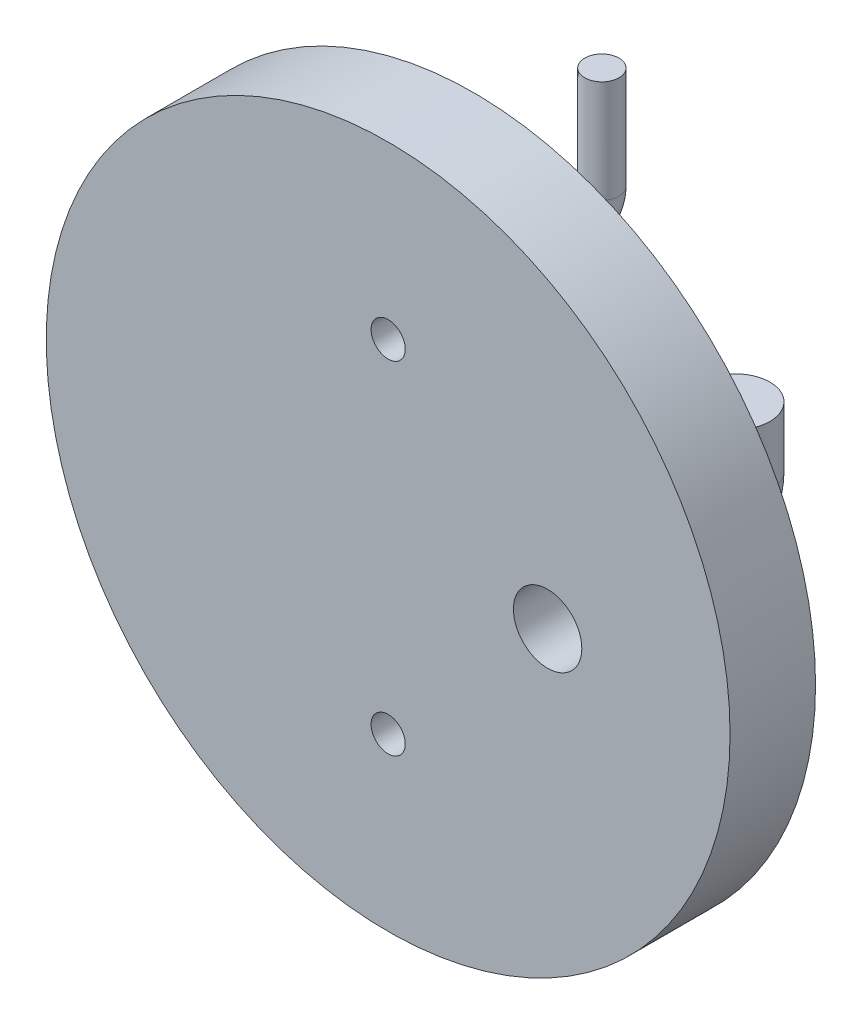
from build123d import *

# Parameters (mm, degrees)
SKETCH1_R           = 40
SKETCH1_R_2         = 2
SKETCH1_R_3         = 4
BOSS_EXTRUDE1_DEPTH = 10
SKETCH5_R           = 2
SKETCH3_R           = 2
SKETCH6_R           = 4


with BuildPart() as part:
    # Sketch1 → Boss-Extrude1 (new body)
    with BuildSketch(Plane.XY):
        Circle(SKETCH1_R)
        with Locations((0, 20)):
            Circle(SKETCH1_R_2, mode=Mode.SUBTRACT)
        with Locations((0, -20)):
            Circle(SKETCH1_R_2, mode=Mode.SUBTRACT)
        with Locations((18.65280258, 0)):
            Circle(SKETCH1_R_3, mode=Mode.SUBTRACT)
    extrude(amount=BOSS_EXTRUDE1_DEPTH)


with BuildPart() as body_2:
    # Sweep4: sweep along a path in Sketch4
    with BuildLine(Plane(origin=(0, 0, 0), x_dir=(0, 0, -1), z_dir=(1, 0, 0))) as sweep4_path:
        Line((17, -35), (17, -23))
        ThreePointArc((17, -23), (15.535533906, -19.464466094), (12, -18))
        Line((12, -18), (0, -18))
    # Sketch5 → Sweep4 (sweep)
    with BuildSketch(Plane.XY):
        with Locations((0, -20)):
            Circle(SKETCH5_R)
    sweep(path=sweep4_path.line)


with BuildPart() as body_3:
    # Sweep5: sweep along a path in Sketch2
    with BuildLine(Plane(origin=(0, 0, 0), x_dir=(0, 0, -1), z_dir=(1, 0, 0))) as sweep5_path:
        Line((17, 35), (17, 23))
        ThreePointArc((17, 23), (15.535533906, 19.464466094), (12, 18))
        Line((12, 18), (0, 18))
    # Sketch3 → Sweep5 (sweep)
    with BuildSketch(Plane(origin=(0, 0, 0), x_dir=(-1, 0, 0), z_dir=(0, 0, -1))):
        with Locations((0, 20)):
            Circle(SKETCH3_R)
    sweep(path=sweep5_path.line)


with BuildPart() as body_4:
    # Sweep6: sweep along a path in Sketch8
    with BuildLine(Plane(origin=(18.65280258, 0, 0), x_dir=(0, 0, -1), z_dir=(1, 0, 0))) as sweep6_path:
        Line((0, 0), (7, 0))
        ThreePointArc((7, 0), (10.535533906, 1.464466094), (12, 5))
        Line((12, 5), (12, 12))
    # Sketch6 → Sweep6 (sweep)
    with BuildSketch(Plane.XY):
        with Locations((18.65280258, 0)):
            Circle(SKETCH6_R)
    sweep(path=sweep6_path.line)


solid = Compound([part.part, body_2.part, body_3.part, body_4.part])
